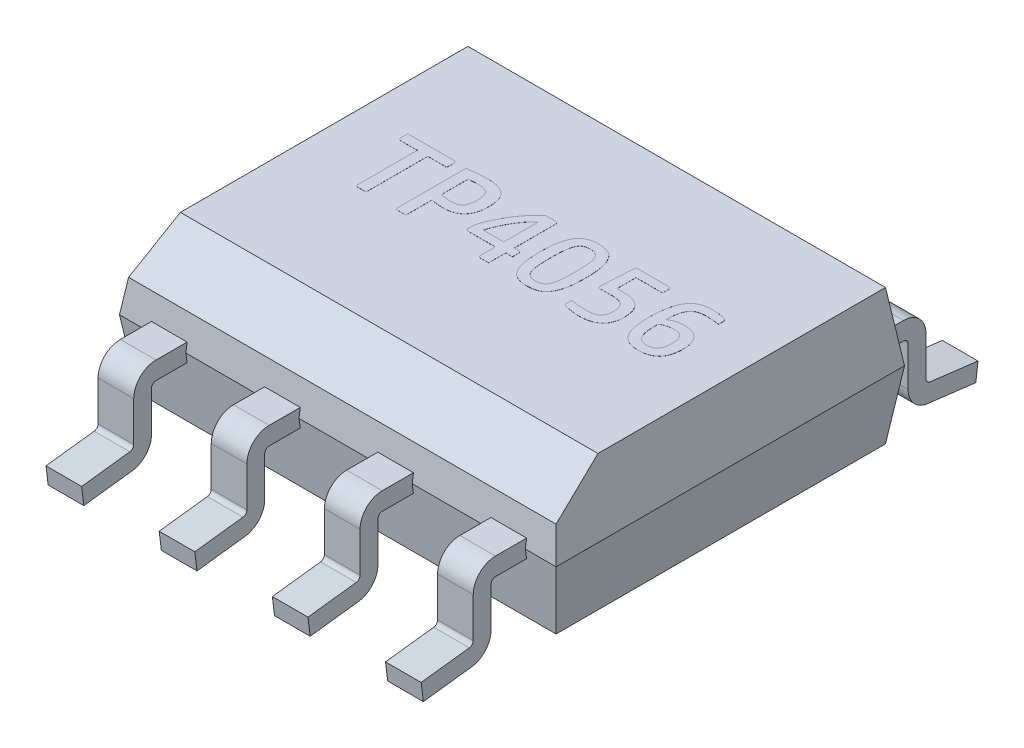
from build123d import *

# Parameters (mm, degrees)
SKETCH1_W                = 4.9
SKETCH1_H                = 3.91
EXTRUDE1_DEPTH           = 0.76
EXTRUDE1_TAPER           = 8
EXTRUDE1_OTHER_WAY_DEPTH = 0.76
EXTRUDE1_OTHER_WAY_TAPER = 8
CHAMFER1_SIZE            = 0.4
CHAMFER1_SIZE2           = 0.469982805
EXTRUDE3_DEPTH           = 0.2
LPATTERN3_COUNT          = 4
LPATTERN3_PITCH          = 1.27
BOSS_EXTRUDE1_DEPTH      = 0.001


with BuildPart() as part:
    # Sketch1 → Extrude1 (new body)
    with BuildSketch(Plane(origin=(0, 0, 0), x_dir=(1, 0, 0), z_dir=(0, 1, 0))):
        Rectangle(SKETCH1_W, SKETCH1_H)
    extrude(amount=EXTRUDE1_DEPTH, taper=EXTRUDE1_TAPER)

    # Sketch1 → Extrude1 other way (add)
    with BuildSketch(Plane(origin=(0, 0, 0), x_dir=(1, 0, 0), z_dir=(0, 1, 0))):
        Rectangle(SKETCH1_W, SKETCH1_H)
    extrude(amount=-EXTRUDE1_OTHER_WAY_DEPTH, taper=EXTRUDE1_OTHER_WAY_TAPER)

    # Chamfer1
    chamfer1_edges = [part.edges().sort_by_distance(p)[0] for p in [
        (0, 0.76, 1.848188966),
    ]]
    chamfer1_side = [part.faces().sort_by_distance(p)[0] for p in [
        (0, 0.37717737, 1.901991178),
    ]]
    chamfer(chamfer1_edges, length=CHAMFER1_SIZE, length2=CHAMFER1_SIZE2, reference=chamfer1_side[0])

    # Sketch5 → Extrude3 (add, symmetric)
    with BuildSketch(Plane(origin=(1.905, 0, 0), x_dir=(0, 0, -1), z_dir=(1, 0, 0))):
        with BuildLine():
            Line((0, 0.1), (-2.29, 0.1))
            ThreePointArc((-2.29, 0.1), (-2.466776695, 0.026776695), (-2.54, -0.15))
            Line((-2.54, -0.15), (-2.54, -0.595502418))
            ThreePointArc((-2.54, -0.595502418), (-2.552552214, -0.62863342), (-2.583906533, -0.645129725))
            Line((-2.583906533, -0.645129725), (-3.124373869, -0.71149077))
            Line((-3.124373869, -0.71149077), (-3.1, -0.91))
            Line((-3.1, -0.91), (-2.559532664, -0.843638955))
            ThreePointArc((-2.559532664, -0.843638955), (-2.40276107, -0.76115743), (-2.34, -0.595502418))
            Line((-2.34, -0.595502418), (-2.34, -0.15))
            ThreePointArc((-2.34, -0.15), (-2.325355339, -0.114644661), (-2.29, -0.1))
            Line((-2.29, -0.1), (0, -0.1))
            Line((0, -0.1), (2.29, -0.1))
            ThreePointArc((2.29, -0.1), (2.325355339, -0.114644661), (2.34, -0.15))
            Line((2.34, -0.15), (2.34, -0.595502418))
            ThreePointArc((2.34, -0.595502418), (2.40276107, -0.76115743), (2.559532664, -0.843638955))
            Line((2.559532664, -0.843638955), (3.1, -0.91))
            Line((3.1, -0.91), (3.124373869, -0.71149077))
            Line((3.124373869, -0.71149077), (2.583906533, -0.645129725))
            ThreePointArc((2.583906533, -0.645129725), (2.552552214, -0.62863342), (2.54, -0.595502418))
            Line((2.54, -0.595502418), (2.54, -0.15))
            ThreePointArc((2.54, -0.15), (2.466776695, 0.026776695), (2.29, 0.1))
            Line((2.29, 0.1), (0, 0.1))
        make_face()
    extrude3 = extrude(amount=EXTRUDE3_DEPTH, both=True)

    # LPattern3: Extrude3 ×4
    with Locations(*[(-i * LPATTERN3_PITCH, 0, 0) for i in range(1, LPATTERN3_COUNT)]):
        add(extrude3)

    # Sketch6 → Boss-Extrude1 (add)
    # profile 1 of 6: a face of its own
    with BuildSketch(Plane(origin=(0, 0.76, 0), x_dir=(1, 0, 0), z_dir=(0, 1, 0))):
        with BuildLine():
            Line((-1.616, 0.553684751), (-1.801333333, 0.553684751))
            add(Edge.make_bspline(
                [(-1.801333333, 0.553684751), (-1.80546528, 0.553888001), (-1.813069102, 0.554262033), (-1.82294525, 0.559980402), (-1.828558504, 0.569868556), (-1.829058576, 0.577387115), (-1.829333333, 0.581518084)],
                knots=[0, 0, 0, 0, 1.09175802, 2.009109741, 2.906132495, 4, 4, 4, 4], degree=3))
            Line((-1.829333333, 0.581518084), (-1.829333333, 0.660351417))
            Line((-1.829333333, 0.660351417), (-1.313, 0.660351417))
            add(Edge.make_bspline(
                [(-1.313, 0.660351417), (-1.309133994, 0.660057633), (-1.301763979, 0.659497574), (-1.292324096, 0.653575973), (-1.286029228, 0.64412075), (-1.285576251, 0.63656825), (-1.285333333, 0.632518084)],
                knots=[0, 0, 0, 0, 1.038606084, 1.9799616, 2.916717433, 4, 4, 4, 4], degree=3))
            Line((-1.285333333, 0.632518084), (-1.285333333, 0.553684751))
            Line((-1.285333333, 0.553684751), (-1.498666667, 0.553684751))
            Line((-1.498666667, 0.553684751), (-1.498666667, -0.139648583))
            Line((-1.498666667, -0.139648583), (-1.589166667, -0.139648583))
            add(Edge.make_bspline(
                [(-1.589166667, -0.139648583), (-1.593123584, -0.139413105), (-1.600391568, -0.138980586), (-1.609881541, -0.133684046), (-1.615379157, -0.124358052), (-1.615780159, -0.117225504), (-1.616, -0.113315249)],
                knots=[0, 0, 0, 0, 1.100319274, 2.021043931, 2.915082964, 4, 4, 4, 4], degree=3))
            Line((-1.616, -0.113315249), (-1.616, 0.553684751))
        make_face()
    # profile 2 of 6: a face of its own
    with BuildSketch(Plane(origin=(0, 0.76, 0), x_dir=(1, 0, 0), z_dir=(0, 1, 0))):
        with BuildLine():
            add(Edge.make_bspline(
                [(-1.141, -0.139648583), (-1.145024528, -0.139437322), (-1.152321941, -0.139054256), (-1.161774128, -0.13356524), (-1.16741397, -0.124231772), (-1.167793068, -0.116954343), (-1.168, -0.112981916)],
                knots=[0, 0, 0, 0, 1.104995996, 2.003616578, 2.910262478, 4, 4, 4, 4], degree=3))
            Line((-1.168, -0.112981916), (-1.168, 0.649684751))
            add(Edge.make_bspline(
                [(-1.168, 0.649684751), (-1.159339141, 0.651164561), (-1.141493114, 0.654213767), (-1.113880838, 0.658218058), (-1.08468056, 0.661583492), (-1.054426486, 0.665010571), (-1.023798572, 0.667574529), (-0.993743917, 0.669624126), (-0.964677084, 0.670848091), (-0.945667748, 0.670962101), (-0.936333333, 0.671018084)],
                knots=[0, 0, 0, 0, 0.905371225, 1.865551503, 2.87456075, 3.934109155, 5.002835044, 6.041279865, 7.038182817, 8, 8, 8, 8], degree=3))
            add(Edge.make_bspline(
                [(-0.936333333, 0.671018084), (-0.925161139, 0.670820878), (-0.903501366, 0.670438549), (-0.872131637, 0.667653742), (-0.843055889, 0.662829449), (-0.816233675, 0.656278769), (-0.791790578, 0.647588323), (-0.769543299, 0.637090757), (-0.74961852, 0.624558615), (-0.731832949, 0.610090569), (-0.716239222, 0.59331268), (-0.702800414, 0.573970525), (-0.691795223, 0.551915655), (-0.682286162, 0.527540958), (-0.675278595, 0.500506694), (-0.670417707, 0.470935521), (-0.667122092, 0.438869574), (-0.666822251, 0.416582545), (-0.666666667, 0.405018084)],
                knots=[0, 0, 0, 0, 1.221592278, 2.368327122, 3.439934449, 4.441827275, 5.383333762, 6.271864917, 7.126372295, 7.950877528, 8.771884137, 9.622907822, 10.516760129, 11.461025944, 12.479232466, 13.563830277, 14.735901945, 16, 16, 16, 16], degree=3))
            add(Edge.make_bspline(
                [(-0.666666667, 0.405018084), (-0.666878643, 0.393286279), (-0.667285445, 0.370771956), (-0.670702052, 0.33835073), (-0.675959012, 0.308669181), (-0.683898539, 0.281741262), (-0.693743446, 0.257402537), (-0.705395653, 0.23548331), (-0.71883965, 0.21583073), (-0.73423071, 0.198625123), (-0.751410036, 0.183612224), (-0.770398858, 0.170852366), (-0.791268079, 0.160360242), (-0.813775389, 0.151832493), (-0.837865275, 0.145710727), (-0.863062621, 0.140923766), (-0.889556991, 0.138324613), (-0.907606042, 0.137901209), (-0.916833333, 0.137684751)],
                knots=[0, 0, 0, 0, 1.340738159, 2.572989716, 3.722679711, 4.781726966, 5.775892878, 6.719161201, 7.614048893, 8.491114654, 9.350810137, 10.215650742, 11.09894828, 12.015433752, 12.961242712, 13.936548032, 14.945092831, 16, 16, 16, 16], degree=3))
            add(Edge.make_bspline(
                [(-0.916833333, 0.137684751), (-0.927117313, 0.137893056), (-0.948336852, 0.138322865), (-0.981008175, 0.141455041), (-1.015361699, 0.146673393), (-1.038685523, 0.151415473), (-1.050666667, 0.153851417)],
                knots=[0, 0, 0, 0, 0.913736864, 1.885366913, 2.913740665, 4, 4, 4, 4], degree=3))
            Line((-1.050666667, 0.153851417), (-1.050666667, -0.139648583))
            Line((-1.050666667, -0.139648583), (-1.141, -0.139648583))
        make_face()
        with BuildLine():
            add(Edge.make_bspline(
                [(-1.050666667, 0.257684751), (-1.041063853, 0.255914299), (-1.021902627, 0.252381582), (-0.993095381, 0.247959406), (-0.964228914, 0.244955428), (-0.944951687, 0.244552472), (-0.935333333, 0.244351417)],
                knots=[0, 0, 0, 0, 1.007720964, 2.010782395, 3.007481797, 4, 4, 4, 4], degree=3))
            add(Edge.make_bspline(
                [(-0.935333333, 0.244351417), (-0.92960828, 0.244452641), (-0.918531029, 0.244648497), (-0.902502652, 0.245999289), (-0.887563432, 0.248114472), (-0.873693026, 0.251208055), (-0.860863421, 0.255551976), (-0.84915725, 0.261167687), (-0.838618496, 0.268261275), (-0.82936792, 0.276927184), (-0.821133595, 0.286984834), (-0.81409471, 0.298689242), (-0.808162077, 0.31191897), (-0.803081945, 0.326734098), (-0.799337881, 0.343451277), (-0.796532953, 0.362104219), (-0.794886622, 0.382821925), (-0.794742136, 0.39729284), (-0.794666667, 0.404851417)],
                knots=[0, 0, 0, 0, 1.102149985, 2.132520274, 3.094561314, 4.005288587, 4.864433688, 5.69679574, 6.497778818, 7.300046324, 8.128620039, 8.992611792, 9.921190233, 10.915625958, 12.002725967, 13.214393402, 14.544997018, 16, 16, 16, 16], degree=3))
            add(Edge.make_bspline(
                [(-0.794666667, 0.404851417), (-0.794812924, 0.41296484), (-0.795089745, 0.428321169), (-0.796647197, 0.450163081), (-0.799575969, 0.469455674), (-0.803728566, 0.486436997), (-0.809103549, 0.501212233), (-0.815391126, 0.514310788), (-0.823138058, 0.525559414), (-0.832015217, 0.535235805), (-0.842189055, 0.543026268), (-0.853190625, 0.549723231), (-0.865332298, 0.554836887), (-0.883411526, 0.559711909), (-0.908336399, 0.563635224), (-0.928982895, 0.564104695), (-0.939833333, 0.564351417)],
                knots=[0, 0, 0, 0, 1.345834005, 2.547268703, 3.628952485, 4.578770012, 5.441601489, 6.232822528, 6.981702335, 7.69890244, 8.401208471, 9.099695782, 9.830499978, 10.577279296, 12.201243438, 14, 14, 14, 14], degree=3))
            add(Edge.make_bspline(
                [(-0.939833333, 0.564351417), (-0.950615195, 0.56430336), (-0.971529244, 0.564210141), (-0.997070934, 0.562457348), (-1.016072397, 0.560969884), (-1.028778196, 0.559532746), (-1.040211502, 0.558390716), (-1.047339065, 0.557114093), (-1.050666667, 0.556518084)],
                knots=[0, 0, 0, 0, 1.744404489, 3.383697977, 4.141534594, 4.828602985, 5.453117021, 6, 6, 6, 6], degree=3))
            Line((-1.050666667, 0.556518084), (-1.050666667, 0.257684751))
        make_face(mode=Mode.SUBTRACT)
    # profile 3 of 6: a face of its own
    with BuildSketch(Plane(origin=(0, 0.76, 0), x_dir=(1, 0, 0), z_dir=(0, 1, 0))):
        with BuildLine():
            add(Edge.make_bspline(
                [(-0.151166667, 0.639018084), (-0.146941655, 0.638785421), (-0.139343097, 0.638366984), (-0.129242865, 0.633265998), (-0.123455125, 0.623832378), (-0.122943357, 0.616596736), (-0.122666667, 0.612684751)],
                knots=[0, 0, 0, 0, 1.140744261, 2.051594506, 2.946585154, 4, 4, 4, 4], degree=3))
            Line((-0.122666667, 0.612684751), (-0.122666667, 0.148351417))
            Line((-0.122666667, 0.148351417), (-0.076833333, 0.148351417))
            add(Edge.make_bspline(
                [(-0.076833333, 0.148351417), (-0.07255028, 0.148130543), (-0.064815657, 0.147731673), (-0.054570934, 0.142460844), (-0.048765649, 0.132766429), (-0.048269785, 0.125373617), (-0.048, 0.121351417)],
                knots=[0, 0, 0, 0, 1.133599091, 2.047129017, 2.937503286, 4, 4, 4, 4], degree=3))
            Line((-0.048, 0.121351417), (-0.048, 0.052351417))
            Line((-0.048, 0.052351417), (-0.122666667, 0.052351417))
            Line((-0.122666667, 0.052351417), (-0.122666667, -0.139648583))
            Line((-0.122666667, -0.139648583), (-0.211333333, -0.139648583))
            add(Edge.make_bspline(
                [(-0.211333333, -0.139648583), (-0.215564309, -0.139422303), (-0.22324956, -0.139011283), (-0.233299741, -0.133778156), (-0.239288363, -0.124398176), (-0.239748174, -0.117129451), (-0.24, -0.113148583)],
                knots=[0, 0, 0, 0, 1.134303615, 2.060377748, 2.937725683, 4, 4, 4, 4], degree=3))
            Line((-0.24, -0.113148583), (-0.24, 0.052351417))
            Line((-0.24, 0.052351417), (-0.5435, 0.052351417))
            add(Edge.make_bspline(
                [(-0.5435, 0.052351417), (-0.547527313, 0.052559592), (-0.554906893, 0.052941048), (-0.564382373, 0.058559261), (-0.570114483, 0.067976691), (-0.570470891, 0.075318537), (-0.570666667, 0.079351417)],
                knots=[0, 0, 0, 0, 1.095026417, 2.006507693, 2.904973583, 4, 4, 4, 4], degree=3))
            Line((-0.570666667, 0.079351417), (-0.570666667, 0.151851417))
            add(Edge.make_bspline(
                [(-0.570666667, 0.151851417), (-0.56748419, 0.162493565), (-0.561008708, 0.184147467), (-0.549349199, 0.216524291), (-0.536534407, 0.249702743), (-0.522093619, 0.283259336), (-0.506345525, 0.317045978), (-0.489170301, 0.350397164), (-0.471021444, 0.383383924), (-0.444978641, 0.426358228), (-0.410151335, 0.478542036), (-0.371936051, 0.527970854), (-0.340170484, 0.565668436), (-0.315336928, 0.591789929), (-0.290301269, 0.616428128), (-0.272804192, 0.63155207), (-0.264166667, 0.639018084)],
                knots=[0, 0, 0, 0, 0.800171304, 1.628132928, 2.47850006, 3.362538927, 4.259674846, 5.163713554, 6.064912158, 6.971737908, 8.783533285, 10.581712021, 11.470441549, 12.334082449, 13.177610931, 14, 14, 14, 14], degree=3))
            Line((-0.264166667, 0.639018084), (-0.151166667, 0.639018084))
        make_face()
        with BuildLine():
            Line((-0.24, 0.148351417), (-0.24, 0.537684751))
            add(Edge.make_bspline(
                [(-0.24, 0.537684751), (-0.246902809, 0.531424039), (-0.260762213, 0.518853831), (-0.280492324, 0.498473165), (-0.299601618, 0.476922087), (-0.324015934, 0.446341053), (-0.352708025, 0.406192609), (-0.383277171, 0.355393414), (-0.410717173, 0.303193061), (-0.434565533, 0.250625504), (-0.455168216, 0.199152192), (-0.466287658, 0.164914053), (-0.471666667, 0.148351417)],
                knots=[0, 0, 0, 0, 0.609917144, 1.224586681, 1.855817368, 2.494795295, 3.785526262, 5.082865254, 6.37289921, 7.6439694, 8.860274618, 10, 10, 10, 10], degree=3))
            Line((-0.471666667, 0.148351417), (-0.24, 0.148351417))
        make_face(mode=Mode.SUBTRACT)
    # profile 4 of 6: a face of its own
    with BuildSketch(Plane(origin=(0, 0.76, 0), x_dir=(1, 0, 0), z_dir=(0, 1, 0))):
        with BuildLine():
            add(Edge.make_bspline(
                [(0.058666667, 0.255018084), (0.058737844, 0.264963303), (0.058877044, 0.284412728), (0.059752907, 0.312915726), (0.060960814, 0.34004615), (0.063133643, 0.365806982), (0.065201961, 0.390251856), (0.068597731, 0.413322875), (0.071891304, 0.435107848), (0.077436025, 0.46170283), (0.085346904, 0.492305461), (0.097094251, 0.525686816), (0.110640544, 0.555081576), (0.126600034, 0.580182803), (0.144422989, 0.60142908), (0.163838962, 0.619184089), (0.185103911, 0.633255294), (0.208186514, 0.643548289), (0.232720086, 0.65122785), (0.258776993, 0.656365886), (0.286236064, 0.659913998), (0.305043613, 0.660203362), (0.314666667, 0.660351417)],
                knots=[0, 0, 0, 0, 1.085915512, 2.123677079, 3.113655991, 4.050680862, 4.946445563, 5.791476721, 6.596293287, 7.35174689, 8.756917613, 10.044336603, 11.211191252, 12.283140136, 13.281981863, 14.231122299, 15.14639335, 16.053080547, 16.981663225, 17.947693025, 18.949918421, 20, 20, 20, 20], degree=3))
            add(Edge.make_bspline(
                [(0.314666667, 0.660351417), (0.324287441, 0.660185098), (0.343083973, 0.659860154), (0.370503318, 0.656576906), (0.396455003, 0.651480704), (0.421048995, 0.644241031), (0.444121103, 0.634092141), (0.46552499, 0.620429866), (0.484672205, 0.602797799), (0.502263338, 0.581862327), (0.517818757, 0.556915861), (0.531644543, 0.527918434), (0.543291378, 0.494557588), (0.551390049, 0.46398231), (0.557062176, 0.437326441), (0.56071756, 0.415470692), (0.56360354, 0.3922101), (0.56636888, 0.36755798), (0.568318277, 0.341429196), (0.569598593, 0.313861677), (0.570451543, 0.2849122), (0.570593901, 0.265129811), (0.570666667, 0.255018084)],
                knots=[0, 0, 0, 0, 1.048884602, 2.049252152, 3.007039148, 3.930993948, 4.839683002, 5.747300714, 6.686800819, 7.667430196, 8.721430359, 9.884084828, 11.16432777, 12.569452303, 13.331211697, 14.136092186, 14.985363755, 15.887361489, 16.841442185, 17.842396784, 18.897145607, 20, 20, 20, 20], degree=3))
            add(Edge.make_bspline(
                [(0.570666667, 0.255018084), (0.570593882, 0.24490636), (0.570451487, 0.225123975), (0.5695988, 0.196174464), (0.568317558, 0.168607064), (0.56637137, 0.14247787), (0.563588842, 0.117772401), (0.560733097, 0.094452383), (0.557061197, 0.072543066), (0.551387947, 0.045888038), (0.543325268, 0.01535581), (0.531615146, -0.017929165), (0.517772832, -0.046906509), (0.502306484, -0.071960295), (0.484723656, -0.092932834), (0.465467052, -0.110383858), (0.444128106, -0.124063896), (0.421047085, -0.134202701), (0.396455538, -0.141445142), (0.370503166, -0.146540566), (0.343084014, -0.149824032), (0.324287455, -0.150148946), (0.314666667, -0.150315249)],
                knots=[0, 0, 0, 0, 1.102778508, 2.157454756, 3.158340482, 4.11235553, 5.0142912, 5.869513371, 6.674338479, 7.436045458, 8.841073307, 10.115523257, 11.278097726, 12.337150531, 13.317712434, 14.253094745, 15.160650006, 16.069276535, 16.993167759, 17.950888852, 18.95118757, 20, 20, 20, 20], degree=3))
            add(Edge.make_bspline(
                [(0.314666667, -0.150315249), (0.305045707, -0.150150005), (0.286248815, -0.149827161), (0.258777865, -0.146522414), (0.232764438, -0.14146351), (0.208158789, -0.134238364), (0.185167194, -0.12402164), (0.16384422, -0.110347536), (0.14443614, -0.092900802), (0.1265521, -0.071973571), (0.110644189, -0.047046313), (0.097128849, -0.0178649), (0.085287941, 0.015320251), (0.077404423, 0.045883272), (0.07191438, 0.072543803), (0.068563527, 0.094486214), (0.065221832, 0.117731921), (0.063112804, 0.142505208), (0.060971968, 0.168602396), (0.059747149, 0.196175809), (0.058878452, 0.225123614), (0.058738303, 0.244906237), (0.058666667, 0.255018084)],
                knots=[0, 0, 0, 0, 1.048159595, 2.047835674, 3.010898863, 3.934215009, 4.836747781, 5.743738133, 6.683057347, 7.670834622, 8.735720855, 9.894965334, 11.168622, 12.571220812, 13.331224489, 14.134567984, 14.990051056, 15.890204215, 16.843625435, 17.843888157, 18.897907919, 20, 20, 20, 20], degree=3))
        make_face()
        with BuildLine():
            add(Edge.make_bspline(
                [(0.176, 0.255018084), (0.176036026, 0.24123901), (0.176105188, 0.21478652), (0.177397862, 0.17678502), (0.178916929, 0.142097897), (0.181343828, 0.110673563), (0.184814561, 0.082299203), (0.189276421, 0.056793026), (0.19540006, 0.034176236), (0.202146189, 0.014136242), (0.210712998, -0.003049928), (0.220595786, -0.017671028), (0.231999583, -0.029742111), (0.245164087, -0.039118149), (0.260003484, -0.04600265), (0.276592246, -0.050763046), (0.29499958, -0.053814807), (0.307931482, -0.054143868), (0.314666667, -0.054315249)],
                knots=[0, 0, 0, 0, 1.720065586, 3.302109874, 4.746364848, 6.054386797, 7.235504498, 8.31426259, 9.283276999, 10.158500407, 10.94942373, 11.672749217, 12.35458554, 13.010863393, 13.677900617, 14.386716477, 15.159770644, 16, 16, 16, 16], degree=3))
            add(Edge.make_bspline(
                [(0.314666667, -0.054315249), (0.32140186, -0.054143872), (0.334333777, -0.053814818), (0.352741005, -0.050763008), (0.369330124, -0.046002776), (0.384168292, -0.039117711), (0.397337312, -0.029743745), (0.408723309, -0.017664494), (0.418665318, -0.00309741), (0.426922426, 0.014223727), (0.434052002, 0.034101412), (0.43980465, 0.056833272), (0.44437681, 0.082291203), (0.447825794, 0.110675515), (0.450211127, 0.142213063), (0.451999042, 0.177112721), (0.453211248, 0.215509656), (0.453291476, 0.242239306), (0.453333333, 0.256184751)],
                knots=[0, 0, 0, 0, 0.837801637, 1.608622177, 2.315390018, 2.980499935, 3.634881571, 4.314747827, 5.035983372, 5.821553091, 6.696573582, 7.661029452, 8.736670631, 9.914375666, 11.218618278, 12.672860793, 14.264158507, 16, 16, 16, 16], degree=3))
            add(Edge.make_bspline(
                [(0.453333333, 0.256184751), (0.453290808, 0.269963522), (0.453209171, 0.296415429), (0.452001754, 0.334423715), (0.450199575, 0.36910042), (0.447823197, 0.400526658), (0.444394694, 0.428859656), (0.439797801, 0.454201771), (0.434090262, 0.476728716), (0.426886512, 0.496359298), (0.418666859, 0.513472317), (0.408727308, 0.527886423), (0.397281193, 0.539776135), (0.38417878, 0.549176589), (0.369296003, 0.555978844), (0.352792518, 0.561075117), (0.334309951, 0.563772706), (0.321396689, 0.564153144), (0.314666667, 0.564351417)],
                knots=[0, 0, 0, 0, 1.724888498, 3.311368699, 4.760023882, 6.071713409, 7.25614286, 8.331085074, 9.29431695, 10.161264417, 10.94508052, 11.664709829, 12.343452131, 13.00157013, 13.670477667, 14.383285692, 15.157414714, 16, 16, 16, 16], degree=3))
            add(Edge.make_bspline(
                [(0.314666667, 0.564351417), (0.307936678, 0.564153123), (0.295023481, 0.563772644), (0.276540473, 0.561075336), (0.260038475, 0.555978112), (0.245150586, 0.549179125), (0.232066907, 0.539766696), (0.220483239, 0.527857787), (0.21077353, 0.513095658), (0.202171921, 0.495951601), (0.195365907, 0.475981291), (0.18930371, 0.453459712), (0.184807554, 0.428072612), (0.181345189, 0.39986258), (0.178910157, 0.368550002), (0.177395397, 0.333862259), (0.176102016, 0.295638552), (0.176035024, 0.268963839), (0.176, 0.255018084)],
                knots=[0, 0, 0, 0, 0.840112208, 1.61196908, 2.322684937, 2.989629159, 3.645815512, 4.322565633, 5.051519069, 5.842332118, 6.710897346, 7.67977665, 8.751563795, 9.925635499, 11.226562608, 12.670616217, 14.259371234, 16, 16, 16, 16], degree=3))
        make_face(mode=Mode.SUBTRACT)
    # profile 5 of 6: a face of its own
    with BuildSketch(Plane(origin=(0, 0.76, 0), x_dir=(1, 0, 0), z_dir=(0, 1, 0))):
        with BuildLine():
            add(Edge.make_bspline(
                [(0.901333333, -0.150315249), (0.895776898, -0.150175684), (0.883488962, -0.149867038), (0.863749732, -0.148731296), (0.841882425, -0.146606509), (0.818957424, -0.144469704), (0.79591126, -0.141370976), (0.77368131, -0.138122286), (0.753551984, -0.134128007), (0.741363224, -0.130244029), (0.735833333, -0.128481916)],
                knots=[0, 0, 0, 0, 0.796878701, 1.762279763, 2.833888293, 3.94665316, 5.063061034, 6.167039385, 7.168408343, 8, 8, 8, 8], degree=3))
            add(Edge.make_bspline(
                [(0.735833333, -0.128481916), (0.733373112, -0.127522899), (0.728806294, -0.125742712), (0.72262557, -0.122649582), (0.717929697, -0.118964194), (0.713317269, -0.113795002), (0.71010598, -0.105852714), (0.709596219, -0.099230403), (0.709333333, -0.095815249)],
                knots=[0, 0, 0, 0, 1.042410069, 1.934986947, 2.715794499, 3.384126467, 4.650983318, 6, 6, 6, 6], degree=3))
            Line((0.709333333, -0.095815249), (0.709333333, -0.039315249))
            add(Edge.make_bspline(
                [(0.709333333, -0.039315249), (0.715160006, -0.040305391), (0.727285288, -0.042365871), (0.746394866, -0.044661185), (0.766964562, -0.047503994), (0.796845354, -0.050519254), (0.835992254, -0.053724858), (0.867825148, -0.054116334), (0.884, -0.054315249)],
                knots=[0, 0, 0, 0, 0.606092644, 1.261276335, 1.973699774, 2.735735615, 4.341369951, 6, 6, 6, 6], degree=3))
            add(Edge.make_bspline(
                [(0.884, -0.054315249), (0.891447791, -0.054239154), (0.90580821, -0.054092431), (0.926519302, -0.052419583), (0.945458512, -0.049652201), (0.962613419, -0.045796205), (0.978114275, -0.041095366), (0.991779892, -0.034897965), (1.003771976, -0.027766939), (1.013990522, -0.01939971), (1.02279906, -0.009926083), (1.030290648, 0.000824724), (1.036651669, 0.012746827), (1.041808368, 0.025838738), (1.045808488, 0.040081837), (1.048546476, 0.055547679), (1.050498096, 0.072190836), (1.050609327, 0.083734131), (1.050666667, 0.089684751)],
                knots=[0, 0, 0, 0, 1.398185654, 2.695904441, 3.898257494, 4.988996653, 5.995254824, 6.933693723, 7.799579971, 8.607676133, 9.404858447, 10.220994232, 11.061046331, 11.936618059, 12.857971729, 13.833926509, 14.883379389, 16, 16, 16, 16], degree=3))
            add(Edge.make_bspline(
                [(1.050666667, 0.089684751), (1.050536795, 0.096355903), (1.050288424, 0.109114082), (1.048467464, 0.127456841), (1.045411793, 0.144113288), (1.040869328, 0.159129229), (1.035149199, 0.172579036), (1.028483805, 0.184701543), (1.020070805, 0.194990082), (1.010684794, 0.203934195), (0.999999448, 0.211516595), (0.988060644, 0.217867654), (0.974842623, 0.222994969), (0.960419039, 0.226969899), (0.944786401, 0.22984623), (0.928014881, 0.232320451), (0.909955643, 0.233305452), (0.897555778, 0.233555772), (0.891166667, 0.233684751)],
                knots=[0, 0, 0, 0, 1.279345708, 2.446672198, 3.531264123, 4.522263961, 5.448478309, 6.331326031, 7.165030621, 7.986594732, 8.811537651, 9.669603307, 10.573860742, 11.525230134, 12.534562881, 13.621037416, 14.774224053, 16, 16, 16, 16], degree=3))
            Line((0.891166667, 0.233684751), (0.759, 0.233684751))
            add(Edge.make_bspline(
                [(0.759, 0.233684751), (0.755125706, 0.234008355), (0.747722474, 0.234626718), (0.739068403, 0.238557942), (0.733901642, 0.243967876), (0.731720172, 0.249854632), (0.730320389, 0.256950295), (0.730544666, 0.262175647), (0.730666667, 0.265018084)],
                knots=[0, 0, 0, 0, 1.416196505, 2.706152273, 3.367475293, 4.095610904, 4.96406887, 6, 6, 6, 6], degree=3))
            Line((0.730666667, 0.265018084), (0.752, 0.639018084))
            Line((0.752, 0.639018084), (1.1205, 0.639018084))
            add(Edge.make_bspline(
                [(1.1205, 0.639018084), (1.124388453, 0.638763091), (1.131424429, 0.638301694), (1.140850201, 0.633347374), (1.145934165, 0.624086898), (1.146408791, 0.617130826), (1.146666667, 0.613351417)],
                knots=[0, 0, 0, 0, 1.111809844, 2.011768219, 2.919743885, 4, 4, 4, 4], degree=3))
            Line((1.146666667, 0.613351417), (1.146666667, 0.543018084))
            Line((1.146666667, 0.543018084), (0.848, 0.543018084))
            Line((0.848, 0.543018084), (0.848, 0.329684751))
            Line((0.848, 0.329684751), (0.925, 0.329684751))
            add(Edge.make_bspline(
                [(0.925, 0.329684751), (0.935618891, 0.329510956), (0.956013642, 0.329177165), (0.985384458, 0.326141134), (1.012280701, 0.321241612), (1.036838647, 0.314307132), (1.058971986, 0.305146591), (1.079184916, 0.294644572), (1.097011709, 0.281768203), (1.112765944, 0.267192336), (1.126522215, 0.250982187), (1.138079335, 0.233050022), (1.147845349, 0.213709095), (1.155204656, 0.192634492), (1.161130808, 0.170246134), (1.164935658, 0.14634142), (1.167574937, 0.121077059), (1.16785581, 0.103747701), (1.168, 0.094851417)],
                knots=[0, 0, 0, 0, 1.311561075, 2.518997529, 3.643028962, 4.685727766, 5.664578448, 6.598004422, 7.493201509, 8.372282907, 9.244046124, 10.112127113, 11.002258201, 11.914087049, 12.864640616, 13.859837426, 14.901315721, 16, 16, 16, 16], degree=3))
            add(Edge.make_bspline(
                [(1.168, 0.094851417), (1.167780317, 0.084397404), (1.167356113, 0.064210907), (1.164003461, 0.035155699), (1.158592452, 0.008386043), (1.150792887, -0.016059002), (1.140680703, -0.038265581), (1.128661121, -0.058483164), (1.114427874, -0.07657479), (1.098097598, -0.092565087), (1.079754196, -0.106402631), (1.05964259, -0.118543737), (1.037480479, -0.128450116), (1.013618354, -0.136656679), (0.987911111, -0.142714155), (0.960575303, -0.147206527), (0.931498667, -0.14990192), (0.911561327, -0.150175104), (0.901333333, -0.150315249)],
                knots=[0, 0, 0, 0, 1.207551738, 2.331759097, 3.374081624, 4.358572907, 5.289262234, 6.187513337, 7.06968183, 7.941160678, 8.820545966, 9.718797069, 10.649486396, 11.61975094, 12.630120337, 13.696957664, 14.818523278, 16, 16, 16, 16], degree=3))
        make_face()
    # profile 6 of 6: a face of its own
    with BuildSketch(Plane(origin=(0, 0.76, 0), x_dir=(1, 0, 0), z_dir=(0, 1, 0))):
        with BuildLine():
            add(Edge.make_bspline(
                [(1.618333333, 0.564351417), (1.609995883, 0.564180638), (1.593897617, 0.56385089), (1.570675445, 0.561642617), (1.54944539, 0.557426824), (1.530053989, 0.551847225), (1.512459079, 0.544380681), (1.496681511, 0.534520032), (1.482607373, 0.522468926), (1.470264643, 0.508062781), (1.459777779, 0.491209073), (1.45038424, 0.472158354), (1.442663858, 0.450477698), (1.436175716, 0.426290523), (1.430999128, 0.399336746), (1.427591292, 0.369353654), (1.424738081, 0.3364021), (1.424252839, 0.31335848), (1.424, 0.301351417)],
                knots=[0, 0, 0, 0, 1.055693703, 2.038373579, 2.94884179, 3.7923709, 4.589456484, 5.360415461, 6.138624445, 6.926752148, 7.752167423, 8.645575014, 9.611317213, 10.660711859, 11.813995999, 13.082565261, 14.479847285, 16, 16, 16, 16], degree=3))
            add(Edge.make_bspline(
                [(1.424, 0.301351417), (1.429114008, 0.30477164), (1.439542061, 0.311745869), (1.456493446, 0.320753605), (1.47443957, 0.329335456), (1.493837114, 0.336911163), (1.514934219, 0.343415922), (1.538251336, 0.347710489), (1.56370036, 0.350696634), (1.581434646, 0.350908035), (1.590666667, 0.351018084)],
                knots=[0, 0, 0, 0, 0.834628565, 1.701904281, 2.602601485, 3.53387628, 4.526345098, 5.594170174, 6.74758595, 8, 8, 8, 8], degree=3))
            add(Edge.make_bspline(
                [(1.590666667, 0.351018084), (1.59923022, 0.350823567), (1.61590593, 0.350444786), (1.640109835, 0.347587371), (1.662761571, 0.342938836), (1.683872813, 0.336514253), (1.703408221, 0.327966154), (1.721254461, 0.317354207), (1.737819658, 0.305216028), (1.752500857, 0.290840858), (1.765822272, 0.27481591), (1.777186965, 0.256632977), (1.786673514, 0.236453826), (1.794475768, 0.214332459), (1.800659644, 0.190247293), (1.804850798, 0.164136102), (1.807613557, 0.136077568), (1.807868431, 0.116691855), (1.808, 0.106684751)],
                knots=[0, 0, 0, 0, 1.097946714, 2.138019305, 3.120243903, 4.059898737, 4.962640168, 5.847236617, 6.717808634, 7.589429392, 8.475143933, 9.384355707, 10.330791644, 11.329007592, 12.388203832, 13.514896273, 14.717163928, 16, 16, 16, 16], degree=3))
            add(Edge.make_bspline(
                [(1.808, 0.106684751), (1.807846108, 0.097345742), (1.807544163, 0.079022069), (1.804991712, 0.052125959), (1.800846706, 0.026397045), (1.795113057, 0.001884415), (1.787470537, -0.0211175), (1.778032164, -0.04261481), (1.766025134, -0.062090034), (1.752378038, -0.080157621), (1.736429003, -0.096192384), (1.718441898, -0.110361232), (1.69824421, -0.122302782), (1.67609308, -0.13261749), (1.651589815, -0.140600049), (1.624647956, -0.146158871), (1.595316897, -0.149715821), (1.5748998, -0.150110824), (1.564333333, -0.150315249)],
                knots=[0, 0, 0, 0, 1.104699766, 2.167484607, 3.192928566, 4.186121728, 5.142215644, 6.057165301, 6.956686932, 7.842732456, 8.730434141, 9.624536555, 10.544336593, 11.500091568, 12.510234128, 13.585345155, 14.750342884, 16, 16, 16, 16], degree=3))
            add(Edge.make_bspline(
                [(1.564333333, -0.150315249), (1.552483792, -0.15006487), (1.5297396, -0.149584287), (1.497182322, -0.144910272), (1.467732333, -0.137116883), (1.441215677, -0.126274696), (1.417543675, -0.112195968), (1.396305541, -0.095275055), (1.377749132, -0.075107495), (1.361202785, -0.052330532), (1.347486791, -0.026278503), (1.335553237, 0.002467069), (1.326261791, 0.034316421), (1.318730257, 0.068956625), (1.313461365, 0.106581948), (1.309432351, 0.147110767), (1.307161246, 0.190603379), (1.306834888, 0.22057115), (1.306666667, 0.236018084)],
                knots=[0, 0, 0, 0, 1.066897822, 2.047820025, 2.954633117, 3.805005918, 4.619501375, 5.427637831, 6.242025661, 7.08092344, 7.956415228, 8.887631971, 9.880342743, 10.940458468, 12.078504818, 13.300501652, 14.608539403, 16, 16, 16, 16], degree=3))
            add(Edge.make_bspline(
                [(1.306666667, 0.236018084), (1.306742852, 0.245907485), (1.306891824, 0.265245308), (1.30769919, 0.293643747), (1.309169061, 0.320823095), (1.311390612, 0.346821544), (1.313950018, 0.371628293), (1.317362857, 0.395176395), (1.321087521, 0.417496728), (1.327043372, 0.445057906), (1.335673322, 0.476930928), (1.3482201, 0.51199089), (1.362997574, 0.54291759), (1.380085344, 0.569737813), (1.399338599, 0.592659905), (1.420327699, 0.612339258), (1.443850194, 0.627872885), (1.469154944, 0.640176437), (1.4963745, 0.649256597), (1.525304161, 0.655719627), (1.555951189, 0.659585587), (1.576933217, 0.660092238), (1.587666667, 0.660351417)],
                knots=[0, 0, 0, 0, 1.019519525, 1.993577523, 2.928545507, 3.825097512, 4.68336765, 5.498996944, 6.277674865, 7.015693916, 8.405098559, 9.67878351, 10.849405715, 11.931315338, 12.947676952, 13.928563934, 14.886407014, 15.841832745, 16.821665775, 17.837349416, 18.893686487, 20, 20, 20, 20], degree=3))
            add(Edge.make_bspline(
                [(1.587666667, 0.660351417), (1.601845112, 0.660131428), (1.629826276, 0.659697279), (1.664224795, 0.655920957), (1.690299916, 0.651770155), (1.708029604, 0.648068226), (1.724080438, 0.644092797), (1.733968347, 0.6405397), (1.738666667, 0.638851417)],
                knots=[0, 0, 0, 0, 1.665138631, 3.286151197, 4.059783792, 4.766362266, 5.413827141, 6, 6, 6, 6], degree=3))
            add(Edge.make_bspline(
                [(1.738666667, 0.638851417), (1.741489672, 0.637776657), (1.746696443, 0.635794361), (1.753321388, 0.6317173), (1.758415177, 0.6273415), (1.762192717, 0.620436615), (1.764830999, 0.611105521), (1.765161538, 0.603371247), (1.765333333, 0.599351417)],
                knots=[0, 0, 0, 0, 1.041991753, 1.921856637, 2.683175509, 3.329061688, 4.611800061, 6, 6, 6, 6], degree=3))
            Line((1.765333333, 0.599351417), (1.765333333, 0.552684751))
            add(Edge.make_bspline(
                [(1.765333333, 0.552684751), (1.751844268, 0.554503999), (1.726405236, 0.557934918), (1.689427983, 0.561401281), (1.653930034, 0.564120709), (1.630394546, 0.564273247), (1.618333333, 0.564351417)],
                knots=[0, 0, 0, 0, 1.10658125, 2.08690182, 3.019596173, 4, 4, 4, 4], degree=3))
        make_face()
        with BuildLine():
            add(Edge.make_bspline(
                [(1.565166667, 0.255018084), (1.55279324, 0.254553956), (1.527800899, 0.253616492), (1.49710991, 0.246781921), (1.473177401, 0.239139993), (1.455916823, 0.231954453), (1.439435954, 0.223274303), (1.429162465, 0.216337291), (1.424, 0.212851417)],
                knots=[0, 0, 0, 0, 1.487388066, 3.004285835, 3.763198547, 4.50931459, 5.250925242, 6, 6, 6, 6], degree=3))
            add(Edge.make_bspline(
                [(1.424, 0.212851417), (1.424048003, 0.20146169), (1.424140292, 0.17956449), (1.425282846, 0.147990822), (1.427332282, 0.118987073), (1.429794942, 0.092422158), (1.43362373, 0.068315665), (1.438559312, 0.046443626), (1.444839216, 0.026801341), (1.452302396, 0.009253335), (1.461149942, -0.006070511), (1.471412227, -0.019321309), (1.483139222, -0.030344804), (1.496195125, -0.039485866), (1.510957207, -0.046055105), (1.527174153, -0.050984911), (1.545129075, -0.053743925), (1.55765761, -0.05411991), (1.564166667, -0.054315249)],
                knots=[0, 0, 0, 0, 1.591973903, 3.060632614, 4.415014137, 5.65594148, 6.788326483, 7.824354301, 8.787008017, 9.666963777, 10.484726272, 11.253653456, 12.00074374, 12.726628094, 13.470199023, 14.248944686, 15.090259368, 16, 16, 16, 16], degree=3))
            add(Edge.make_bspline(
                [(1.564166667, -0.054315249), (1.569615342, -0.054177789), (1.580156093, -0.053911864), (1.59535814, -0.052147892), (1.609349243, -0.048912286), (1.622186605, -0.044667568), (1.633863606, -0.039122473), (1.644320338, -0.032301883), (1.653355533, -0.023933508), (1.66150968, -0.014580161), (1.668263062, -0.003728721), (1.674325854, 0.008190599), (1.679456184, 0.021362985), (1.683640987, 0.035807498), (1.68669827, 0.051494139), (1.68908151, 0.068400472), (1.69034862, 0.086554358), (1.690558556, 0.099071932), (1.690666667, 0.105518084)],
                knots=[0, 0, 0, 0, 1.11544537, 2.157887867, 3.126232104, 4.050498536, 4.920337188, 5.765668411, 6.594934869, 7.43373834, 8.298132756, 9.203453815, 10.168587176, 11.187119995, 12.277766124, 13.437383705, 14.680334242, 16, 16, 16, 16], degree=3))
            add(Edge.make_bspline(
                [(1.690666667, 0.105518084), (1.690469751, 0.116091499), (1.690092709, 0.136336806), (1.686291241, 0.160926123), (1.681982551, 0.179062811), (1.677430983, 0.191440302), (1.671886283, 0.202875742), (1.665404208, 0.213456947), (1.657766973, 0.223017608), (1.64870609, 0.23136444), (1.638348019, 0.238461461), (1.626711627, 0.244610998), (1.613540261, 0.249169214), (1.598889364, 0.252767223), (1.582548804, 0.254651319), (1.571115207, 0.254892569), (1.565166667, 0.255018084)],
                knots=[0, 0, 0, 0, 1.969316669, 3.770723431, 4.624672134, 5.440405487, 6.223130907, 6.990427905, 7.748939441, 8.496413608, 9.27776775, 10.083714065, 10.94192189, 11.868738022, 12.891171561, 14, 14, 14, 14], degree=3))
        make_face(mode=Mode.SUBTRACT)
    extrude(amount=BOSS_EXTRUDE1_DEPTH)


solid = part.part
